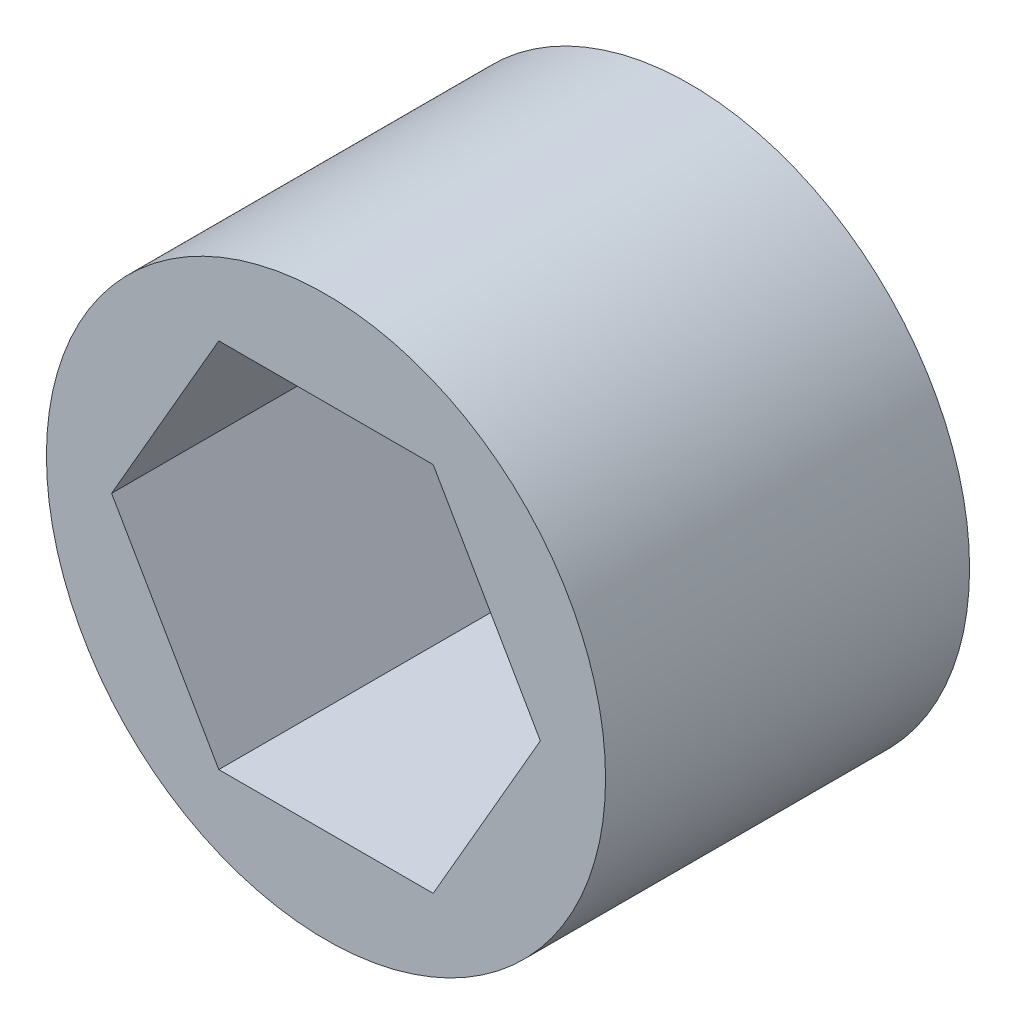
from build123d import *

# Parameters (mm, degrees)
SKETCH2_R           = 9.7536
BOSS_EXTRUDE2_DEPTH = 6.35


with BuildPart() as part:
    # Sketch2 → Boss-Extrude2 (new, symmetric)
    with BuildSketch(Plane.XY):
        with Locations(Location((0, 0, 0), (0, 0, 180))):
            Circle(SKETCH2_R)
        Polygon((-3.739497694, 6.477), (-7.478995387, 0), (-3.739497694, -6.477), (3.739497694, -6.477), (7.478995387, 0), (3.739497694, 6.477), align=None, mode=Mode.SUBTRACT)
    extrude(amount=BOSS_EXTRUDE2_DEPTH, both=True)


solid = part.part
